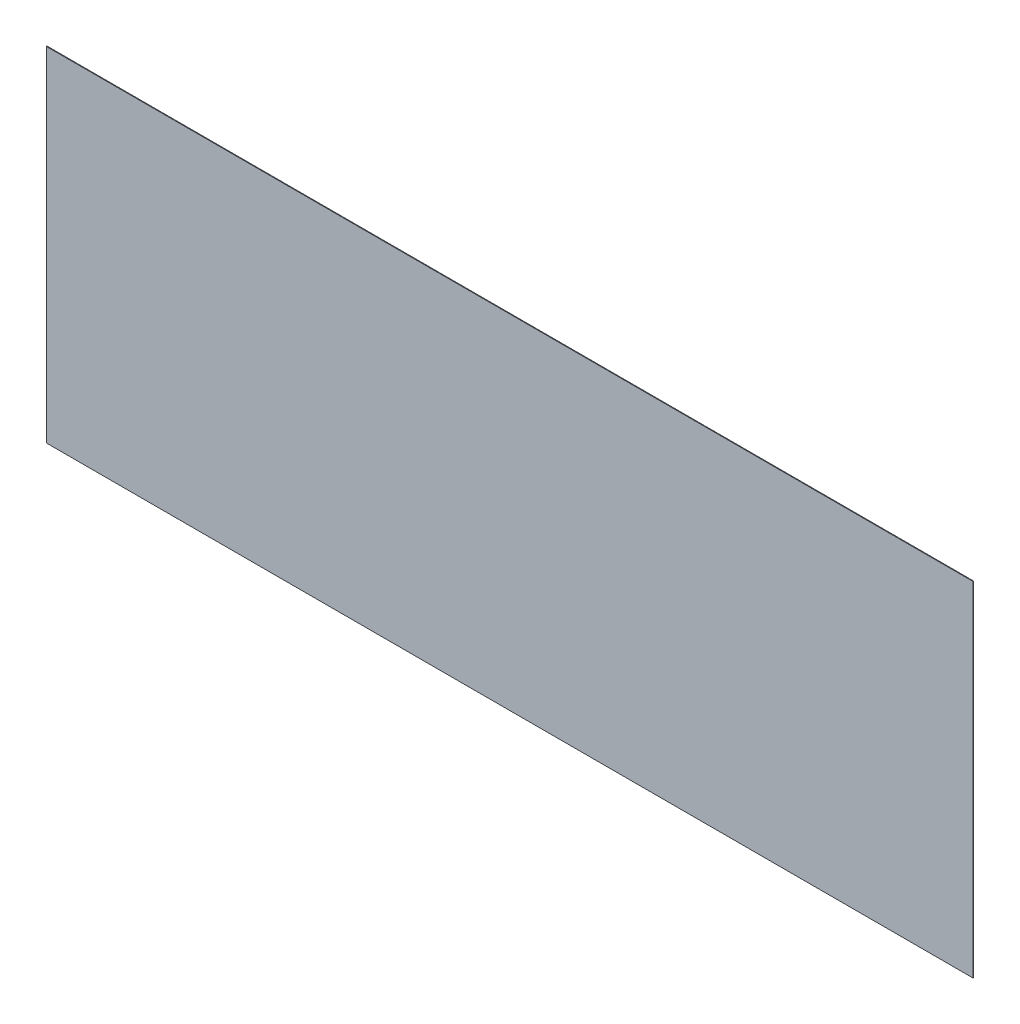
from build123d import *

# Parameters (mm, degrees)
SKETCH1_W        = 275
SKETCH1_H        = 101.925
DIMENSIONS_DEPTH = 0.1


with BuildPart() as part:
    # Sketch1 → Dimensions (new, symmetric)
    with BuildSketch(Plane.XY):
        with Locations((0, 50.9625)):
            Rectangle(SKETCH1_W, SKETCH1_H)
    extrude(amount=DIMENSIONS_DEPTH, both=True)


solid = part.part
